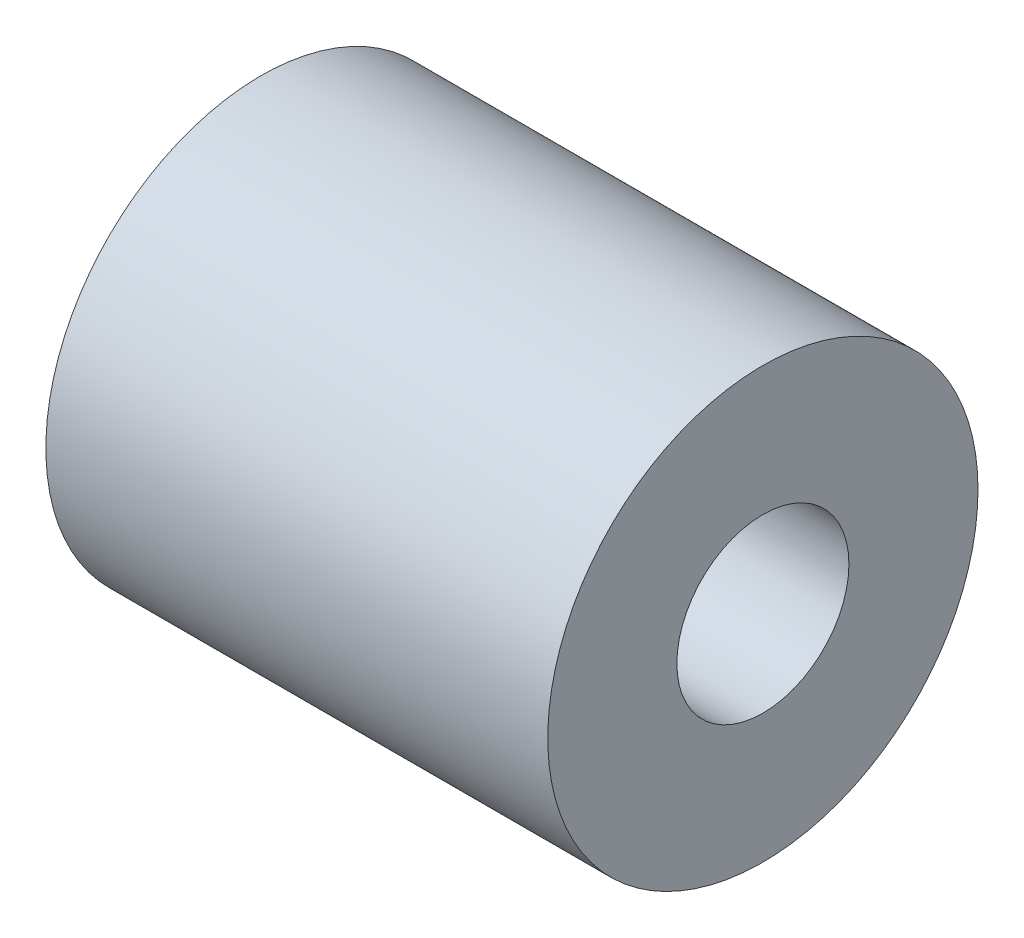
from build123d import *

# Parameters (mm, degrees)
SKETCH1_R           = 15
BOSS_EXTRUDE1_DEPTH = 17.5
SKETCH2_R           = 6
CUT_EXTRUDE1_DEPTH  = 17.5
SKETCH3_R           = 4
CUT_EXTRUDE2_DEPTH  = 17.5


with BuildPart() as part:
    # Sketch1 → Boss-Extrude1 (new, symmetric)
    with BuildSketch(Plane(origin=(0, 0, 0), x_dir=(0, 0, -1), z_dir=(1, 0, 0))):
        Circle(SKETCH1_R)
    extrude(amount=BOSS_EXTRUDE1_DEPTH, both=True)

    # Sketch2 → Cut-Extrude1 (cut)
    with BuildSketch(Plane(origin=(17.5, 0, 0), x_dir=(0, 0, -1), z_dir=(1, 0, 0))):
        Circle(SKETCH2_R)
    extrude(amount=-CUT_EXTRUDE1_DEPTH, mode=Mode.SUBTRACT)

    # Sketch3 → Cut-Extrude2 (cut)
    with BuildSketch(Plane.ZY.offset(17.5)):
        Circle(SKETCH3_R)
    extrude(amount=-CUT_EXTRUDE2_DEPTH, mode=Mode.SUBTRACT)


solid = part.part
